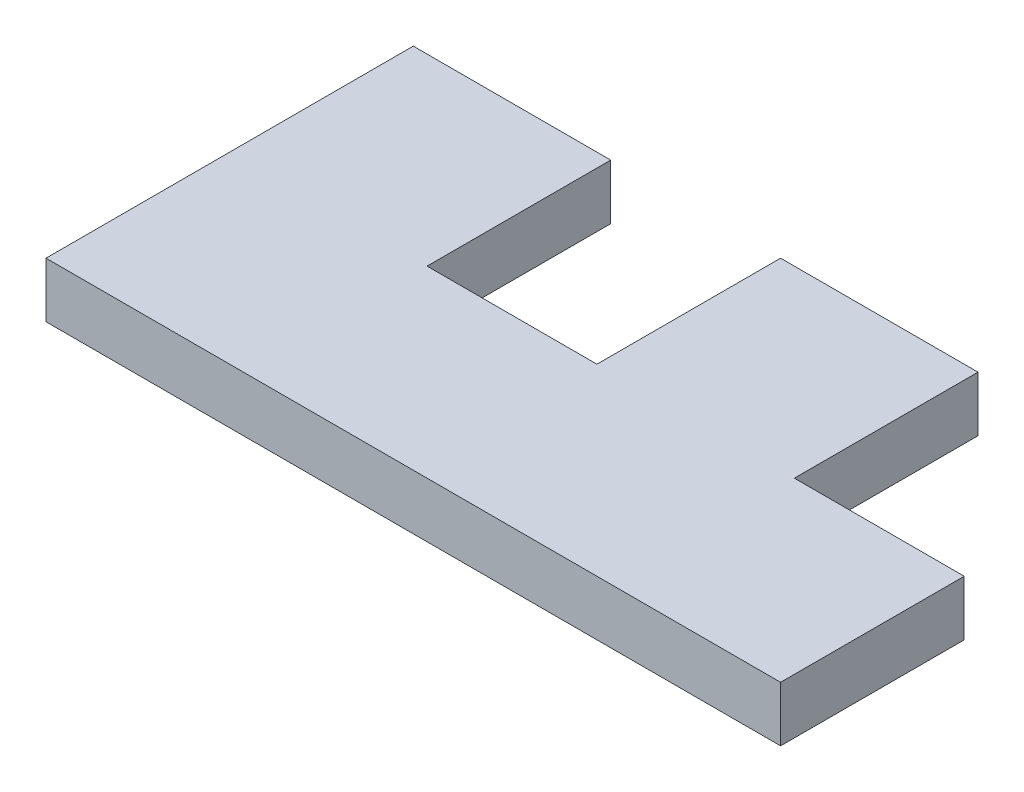
from build123d import *

# Parameters (mm, degrees)
SKETCH1_W           = 40
SKETCH1_H           = 20
BOSS_EXTRUDE1_DEPTH = 3
SKETCH2_W           = 9.25
SKETCH2_H           = 10
CUT_EXTRUDE1_DEPTH  = 3


with BuildPart() as part:
    # Sketch1 → Boss-Extrude1 (new body)
    with BuildSketch(Plane(origin=(0, 0, 0), x_dir=(1, 0, 0), z_dir=(0, 1, 0))):
        with Locations((20, 10)):
            Rectangle(SKETCH1_W, SKETCH1_H)
    extrude(amount=BOSS_EXTRUDE1_DEPTH)

    # Sketch2 → Cut-Extrude1 (cut)
    with BuildSketch(Plane(origin=(0, 3, 0), x_dir=(1, 0, 0), z_dir=(0, 1, 0))):
        with Locations((15.375, 15)):
            Rectangle(SKETCH2_W, SKETCH2_H)
        with Locations((35.375, 15)):
            Rectangle(SKETCH2_W, SKETCH2_H)
    extrude(amount=-CUT_EXTRUDE1_DEPTH, mode=Mode.SUBTRACT)


solid = part.part
